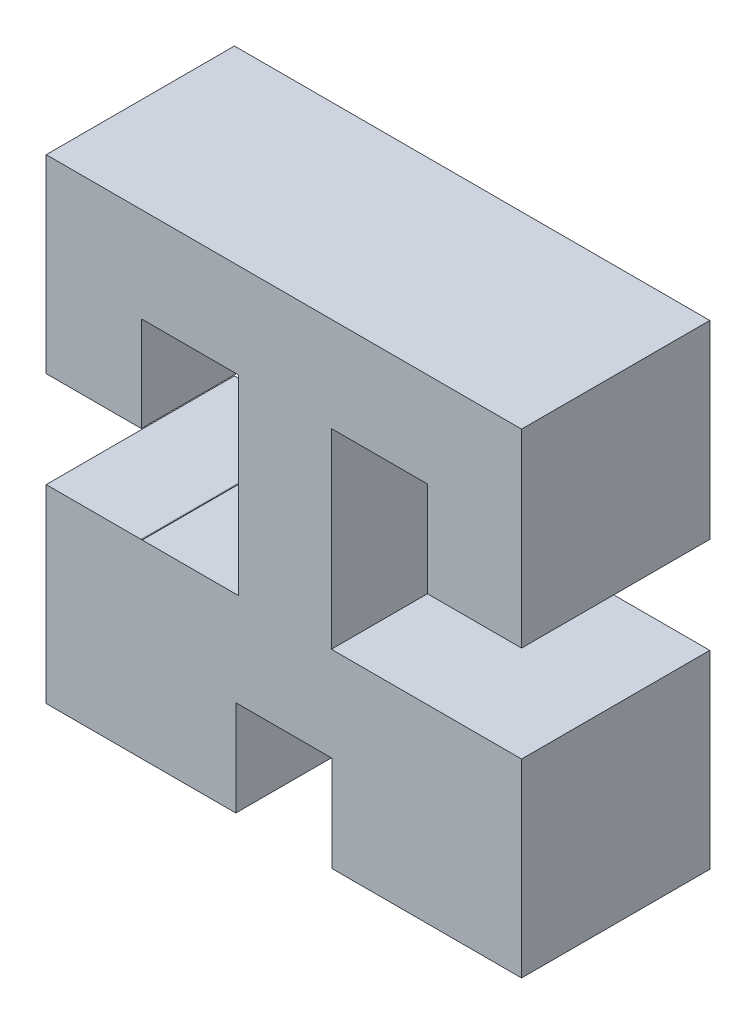
from build123d import *

# Parameters (mm, degrees)
BOSS_EXTRUDE1_DEPTH = 9.899999946


with BuildPart() as part:
    # Sketch1 → Boss-Extrude1 (new body)
    with BuildSketch(Plane(origin=(0, 0, 0), x_dir=(-1, 0, 0), z_dir=(0, 0, -1))):
        Polygon((30.050000664, 0), (30.050000664, 9.973500704), (25.049001075, 9.973500704), (25.049001075, 10.000000559), (25.001000706, 10.000000559), (25.001000706, 9.974000824), (19.949001889, 9.974000824), (19.949001889, 20.025999921), (25.001000706, 20.025999921), (25.001000706, 20.000001118), (25.050001316, 20.000001118), (25.050001316, 15.026001504), (30.050000664, 15.026001504), (30.050000664, 25.000002328), (5.050000664, 25.000002328), (5.050000664, 15.026001504), (9.999000318, 15.026001504), (9.999000318, 20.025999921), (15.051501118, 20.025999921), (15.051501118, 9.973500704), (10.051000718, 9.973500704), (5.050000664, 9.973500704), (5.050000664, 0), (15.024001023, 0), (15.024001023, 5.026000479), (20.076501822, 5.026000479), (20.076501822, 0), align=None)
    extrude(amount=-BOSS_EXTRUDE1_DEPTH)


solid = part.part
